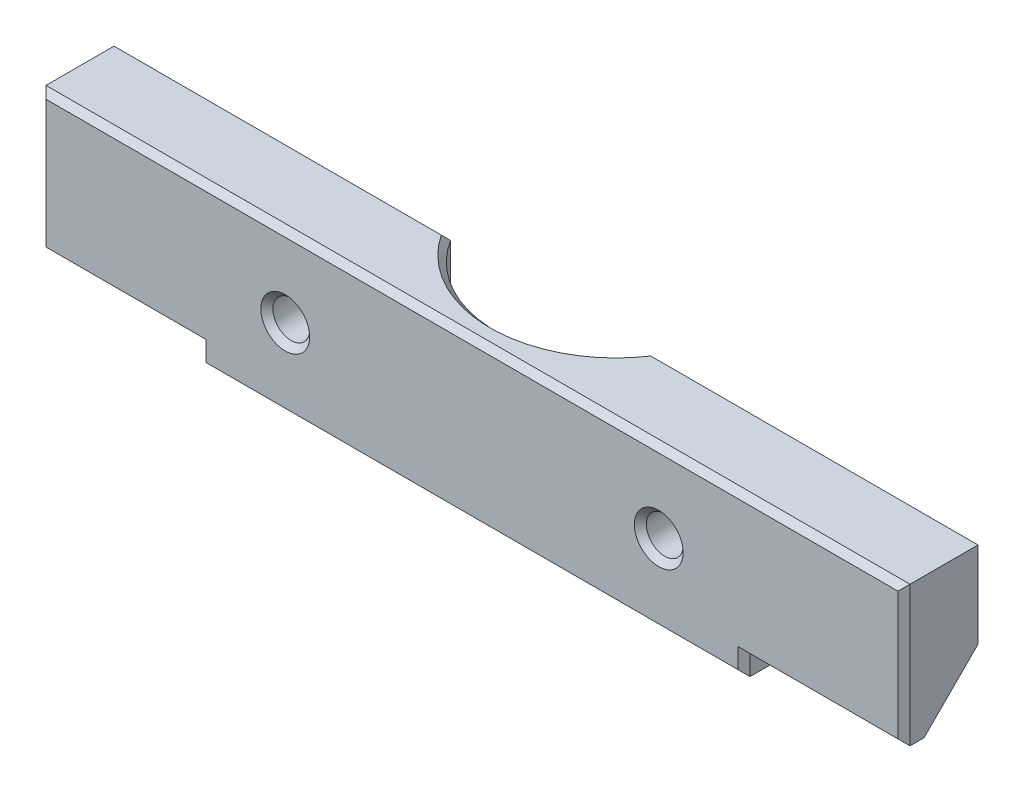
from build123d import *

# Parameters (mm, degrees)
SKIZZE1_W                       = 68
SKIZZE1_H                       = 20
AUFSATZ_LINEAR_AUSTRAGEN1_DEPTH = 10
AUFSATZ_LINEAR_AUSTRAGEN2_DEPTH = 20
SKIZZE3_R                       = 15
SCHNITT_LINEAR_AUSTRAGEN1_DEPTH = 20
SKIZZE4_R                       = 2.3
SCHNITT_LINEAR_AUSTRAGEN2_DEPTH = 20
SKIZZE5_R                       = 3.75
SCHNITT_LINEAR_AUSTRAGEN3_DEPTH = 3
SCHNITT_LINEAR_AUSTRAGEN4_DEPTH = 20
FASE3_SIZE                      = 0.75


with BuildPart() as part:
    # Skizze1 → Aufsatz-Linear austragen1 (new body)
    with BuildSketch(Plane.XY):
        with Locations((0, 10)):
            Rectangle(SKIZZE1_W, SKIZZE1_H)
    extrude(amount=AUFSATZ_LINEAR_AUSTRAGEN1_DEPTH)

    # Skizze2 → Aufsatz-Linear austragen2 (add)
    with BuildSketch(Plane.ZY.offset(34)):
        Polygon((10, 0), (0, 10), (0, 20), (10, 20), align=None)
    aufsatz_linear_austragen2 = extrude(amount=AUFSATZ_LINEAR_AUSTRAGEN2_DEPTH)

    # Spiegeln1: Aufsatz-Linear austragen2 across plane
    add(aufsatz_linear_austragen2.mirror(Plane(origin=(0, 0, 0), x_dir=(0, 0, 1), z_dir=(1, 0, 0))))

    # Skizze3 → Schnitt-Linear austragen1 (cut)
    with BuildSketch(Plane.XZ):
        with Locations((0, -8)):
            Circle(SKIZZE3_R)
    extrude(amount=-SCHNITT_LINEAR_AUSTRAGEN1_DEPTH, mode=Mode.SUBTRACT)

    # Skizze4 → Schnitt-Linear austragen2 (cut)
    with BuildSketch(Plane(origin=(0, 0, 0), x_dir=(-1, 0, 0), z_dir=(0, 0, -1))):
        with Locations((-23.34428877, 10)):
            Circle(SKIZZE4_R)
        with Locations(Location((23.34428877, 10, 0), (0, 0, 180))):
            Circle(SKIZZE4_R)
    extrude(amount=-SCHNITT_LINEAR_AUSTRAGEN2_DEPTH, mode=Mode.SUBTRACT)

    # Skizze5 → Schnitt-Linear austragen3 (cut)
    with BuildSketch(Plane(origin=(0, 0, 0), x_dir=(-1, 0, 0), z_dir=(0, 0, -1))):
        with Locations((-23.34428877, 10)):
            Circle(SKIZZE5_R)
        with Locations((23.34428877, 10)):
            Circle(SKIZZE5_R)
    extrude(amount=-SCHNITT_LINEAR_AUSTRAGEN3_DEPTH, mode=Mode.SUBTRACT)

    # Skizze6 → Schnitt-Linear austragen4 (cut)
    with BuildSketch(Plane.ZY.offset(54)):
        Polygon((10, 2.5), (4.852604626, 2.5), (4.852604626, -2.668604054), (13.586779437, -2.788104879), (13.586779437, 2.151024835), align=None)
    schnitt_linear_austragen4 = extrude(amount=-SCHNITT_LINEAR_AUSTRAGEN4_DEPTH, mode=Mode.SUBTRACT)

    # Spiegeln3: Schnitt-Linear austragen4 across plane
    add(schnitt_linear_austragen4.mirror(Plane(origin=(0, 0, 0), x_dir=(0, 0, 1), z_dir=(1, 0, 0))), mode=Mode.SUBTRACT)

    # Fase3
    fase3_edges = [part.edges().sort_by_distance(p)[0] for p in [
        (54, 11.25, 10),
        (44, 2.5, 10),
        (34, 1.25, 10),
        (0, 0, 10),
        (-34, 5, 0),
        (-54, 15, 0),
        (54, 15, 0),
        (-33.34428877, 20, 0),
        (23.34428877, 0, 0),
        (0, 20, 7),
        (0, 0, 7),
        (0, 20, 10),
        (34, 5, 0),
        (-23.34428877, 0, 0),
        (25.64428877, 10, 10),
        (-25.64428877, 10, 10),
        (33.34428877, 20, 0),
        (27.09428877, 10, 0),
        (-19.59428877, 10, 0),
        (-54, 11.25, 10),
        (-44, 2.5, 10),
        (-34, 1.25, 10),
    ]]
    chamfer(fase3_edges, length=FASE3_SIZE)


solid = part.part
